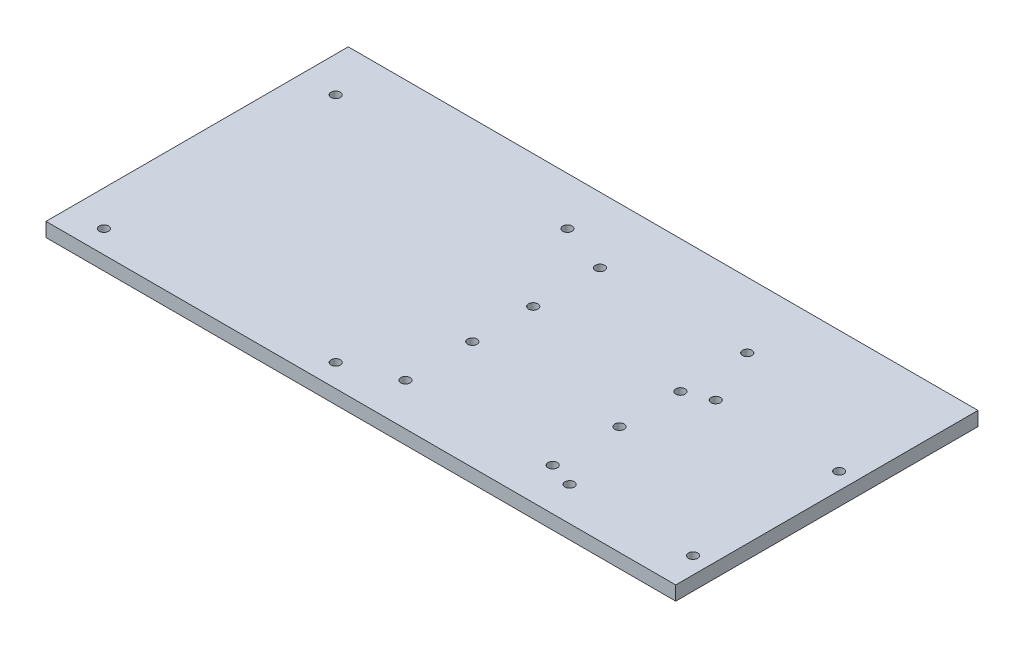
from build123d import *

# Parameters (mm, degrees)
SKETCH1_W                       = 250
SKETCH1_H                       = 120
BOSS_EXTRUDE1_DEPTH             = 5.588
F_3_0MM_CLEARANCE_DOWEL_HOLE2_D = 3.7


with BuildPart() as part:
    # Sketch1 → Boss-Extrude1 (new body)
    with BuildSketch(Plane(origin=(0, 0, 0), x_dir=(1, 0, 0), z_dir=(0, 1, 0))):
        Rectangle(SKETCH1_W, SKETCH1_H)
    extrude(amount=BOSS_EXTRUDE1_DEPTH)

    # Ø3.0mm Clearance Dowel Hole2 (through all)
    with Locations(Plane(origin=(-44.960960081, 0, -163.688232646), x_dir=(-1, 0, 0), z_dir=(0, -1, 0))):
        with Locations((-45.935960081, -156.248232646), (-25.960960081, -122.688232646), (-45.935960081, -129.728232646), (-45.935960081, -180.428232646), (-45.935960081, -206.948232646), (-25.960960081, -214.688232646), (66.039039919, -214.688232646), (-104.385960081, -206.948232646), (-104.385960081, -180.428232646), (-104.385960081, -156.248232646), (-104.385960081, -129.728232646), (-163.338823355, -210.188232646), (-163.338823355, -152.188232646), (-114.338823355, -152.188232646), (-114.338823355, -210.188232646), (66.039039919, -122.688232646)):
            Hole(F_3_0MM_CLEARANCE_DOWEL_HOLE2_D / 2)


solid = part.part
